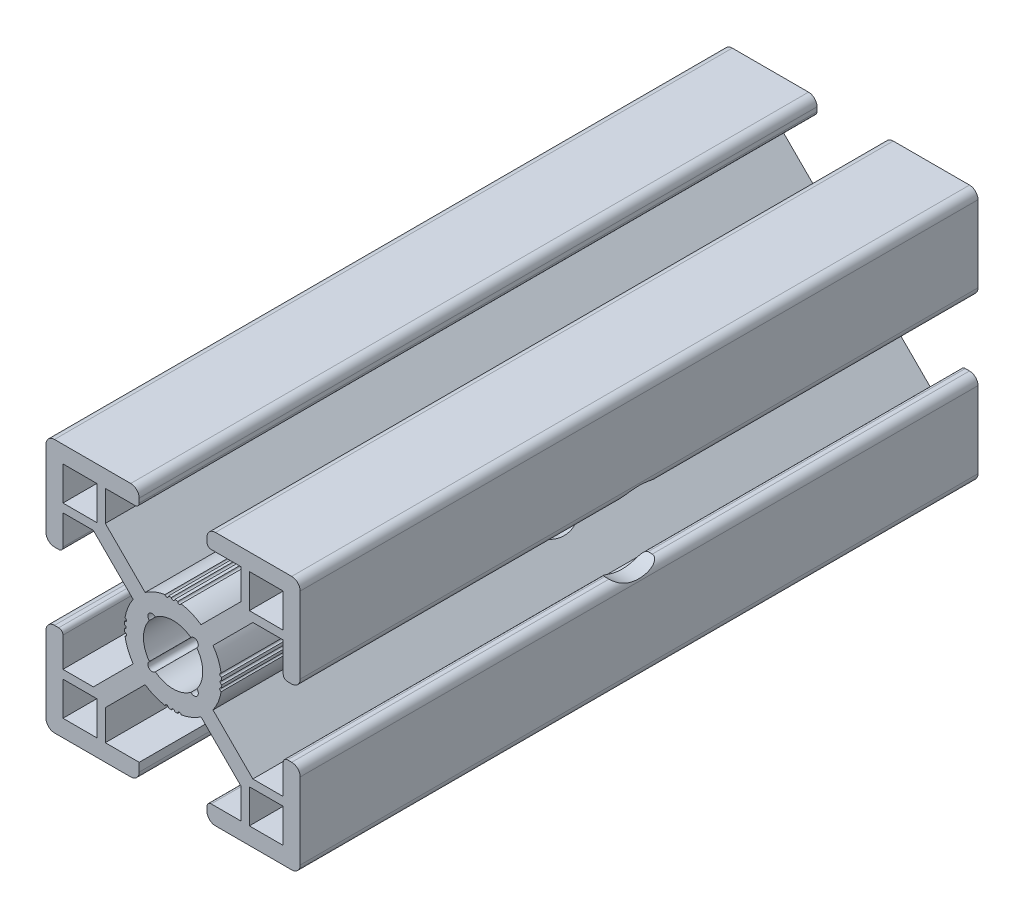
from build123d import *

# Parameters (mm, degrees)
SKETCH1_W               = 4
SKETCH1_H               = 4
BOSS_EXTRUDE1_DEPTH     = 40
CUT_EXTRUDE1_DEPTH      = 46.276925691
CUT_EXTRUDE1_DEPTH_BACK = 46.276925691
SKETCH2_R               = 4.75


with BuildPart() as part:
    # Sketch1 → Boss-Extrude1 (new, symmetric)
    with BuildSketch(Plane.XY):
        with BuildLine():
            Line((-15, 14), (-15, 5))
            ThreePointArc((-15, 5), (-14.707106781, 4.292893219), (-14, 4))
            Line((-14, 4), (-13.5, 4))
            ThreePointArc((-13.5, 4), (-13.146446609, 4.146446609), (-13, 4.5))
            Line((-13, 4.5), (-13, 8))
            Line((-13, 8), (-9.414213562, 8))
            Line((-9.414213562, 8), (-4.711011126, 3.296797563))
            ThreePointArc((-4.711011126, 3.296797563), (-5.322383956, 2.17594325), (-5.671345569, 0.947807702))
            ThreePointArc((-5.671345569, 0.947807702), (-5.502585747, 0.723913043), (-5.723511591, 0.551284925))
            ThreePointArc((-5.723511591, 0.551284925), (-5.737706139, 0.375803491), (-5.746521739, 0.199969752))
            ThreePointArc((-5.746521739, 0.199969752), (-5.607354194, 0.140186212), (-5.55, 0))
            ThreePointArc((-5.55, 0), (-5.607354194, -0.140186212), (-5.746521739, -0.199969752))
            ThreePointArc((-5.746521739, -0.199969752), (-5.737706139, -0.375803491), (-5.723511591, -0.551284925))
            ThreePointArc((-5.723511591, -0.551284925), (-5.502585747, -0.723913043), (-5.671345569, -0.947807702))
            ThreePointArc((-5.671345569, -0.947807702), (-5.322383956, -2.17594325), (-4.711011126, -3.296797563))
            Line((-4.711011126, -3.296797563), (-9.414213562, -8))
            Line((-9.414213562, -8), (-13, -8))
            Line((-13, -8), (-13, -4.5))
            ThreePointArc((-13, -4.5), (-13.146446609, -4.146446609), (-13.5, -4))
            Line((-13.5, -4), (-14, -4))
            ThreePointArc((-14, -4), (-14.707106781, -4.292893219), (-15, -5))
            Line((-15, -5), (-15, -14))
            ThreePointArc((-15, -14), (-14.707106781, -14.707106781), (-14, -15))
            Line((-14, -15), (-5, -15))
            ThreePointArc((-5, -15), (-4.292893219, -14.707106781), (-4, -14))
            Line((-4, -14), (-4, -13))
            Line((-4, -13), (-8, -13))
            Line((-8, -13), (-8, -9.414213562))
            Line((-8, -9.414213562), (-3.296797563, -4.711011126))
            ThreePointArc((-3.296797563, -4.711011126), (-2.17594325, -5.322383956), (-0.947807702, -5.671345569))
            ThreePointArc((-0.947807702, -5.671345569), (-0.723913043, -5.502585747), (-0.551284925, -5.723511591))
            ThreePointArc((-0.551284925, -5.723511591), (-0.375803491, -5.737706139), (-0.199969752, -5.746521739))
            ThreePointArc((-0.199969752, -5.746521739), (-0.140186212, -5.607354194), (0, -5.55))
            ThreePointArc((0, -5.55), (0.140186212, -5.607354194), (0.199969752, -5.746521739))
            ThreePointArc((0.199969752, -5.746521739), (0.375803491, -5.737706139), (0.551284925, -5.723511591))
            ThreePointArc((0.551284925, -5.723511591), (0.723913043, -5.502585747), (0.947807702, -5.671345569))
            ThreePointArc((0.947807702, -5.671345569), (2.17594325, -5.322383956), (3.296797563, -4.711011126))
            Line((3.296797563, -4.711011126), (8, -9.414213562))
            Line((8, -9.414213562), (8, -13))
            Line((8, -13), (4.5, -13))
            ThreePointArc((4.5, -13), (4.146446609, -13.146446609), (4, -13.5))
            Line((4, -13.5), (4, -14))
            ThreePointArc((4, -14), (4.292893219, -14.707106781), (5, -15))
            Line((5, -15), (14, -15))
            ThreePointArc((14, -15), (14.707106781, -14.707106781), (15, -14))
            Line((15, -14), (15, -5))
            ThreePointArc((15, -5), (14.707106781, -4.292893219), (14, -4))
            Line((14, -4), (13.5, -4))
            ThreePointArc((13.5, -4), (13.146446609, -4.146446609), (13, -4.5))
            Line((13, -4.5), (13, -8))
            Line((13, -8), (9.414213562, -8))
            Line((9.414213562, -8), (4.711011126, -3.296797563))
            ThreePointArc((4.711011126, -3.296797563), (5.322383956, -2.17594325), (5.671345569, -0.947807702))
            ThreePointArc((5.671345569, -0.947807702), (5.502585747, -0.723913043), (5.723511591, -0.551284925))
            ThreePointArc((5.723511591, -0.551284925), (5.737706139, -0.375803491), (5.746521739, -0.199969752))
            ThreePointArc((5.746521739, -0.199969752), (5.607354194, -0.140186212), (5.55, 0))
            ThreePointArc((5.55, 0), (5.607354194, 0.140186212), (5.746521739, 0.199969752))
            ThreePointArc((5.746521739, 0.199969752), (5.737706139, 0.375803491), (5.723511591, 0.551284925))
            ThreePointArc((5.723511591, 0.551284925), (5.502585747, 0.723913043), (5.671345569, 0.947807702))
            ThreePointArc((5.671345569, 0.947807702), (5.322383956, 2.17594325), (4.711011126, 3.296797563))
            Line((4.711011126, 3.296797563), (9.414213562, 8))
            Line((9.414213562, 8), (13, 8))
            Line((13, 8), (13, 4.5))
            ThreePointArc((13, 4.5), (13.146446609, 4.146446609), (13.5, 4))
            Line((13.5, 4), (14, 4))
            ThreePointArc((14, 4), (14.707106781, 4.292893219), (15, 5))
            Line((15, 5), (15, 14))
            ThreePointArc((15, 14), (14.707106781, 14.707106781), (14, 15))
            Line((14, 15), (5, 15))
            ThreePointArc((5, 15), (4.292893219, 14.707106781), (4, 14))
            Line((4, 14), (4, 13.5))
            ThreePointArc((4, 13.5), (4.146446609, 13.146446609), (4.5, 13))
            Line((4.5, 13), (8, 13))
            Line((8, 13), (8, 9.414213562))
            Line((8, 9.414213562), (3.296797563, 4.711011126))
            ThreePointArc((3.296797563, 4.711011126), (2.17594325, 5.322383956), (0.947807702, 5.671345569))
            ThreePointArc((0.947807702, 5.671345569), (0.723913043, 5.502585747), (0.551284925, 5.723511591))
            ThreePointArc((0.551284925, 5.723511591), (0.375803491, 5.737706139), (0.199969752, 5.746521739))
            ThreePointArc((0.199969752, 5.746521739), (0.140186212, 5.607354194), (0, 5.55))
            ThreePointArc((0, 5.55), (-0.140186212, 5.607354194), (-0.199969752, 5.746521739))
            ThreePointArc((-0.199969752, 5.746521739), (-0.375803491, 5.737706139), (-0.551284925, 5.723511591))
            ThreePointArc((-0.551284925, 5.723511591), (-0.723913043, 5.502585747), (-0.947807702, 5.671345569))
            ThreePointArc((-0.947807702, 5.671345569), (-2.17594325, 5.322383956), (-3.296797563, 4.711011126))
            Line((-3.296797563, 4.711011126), (-8, 9.414213562))
            Line((-8, 9.414213562), (-8, 13))
            Line((-8, 13), (-4.5, 13))
            ThreePointArc((-4.5, 13), (-4.146446609, 13.146446609), (-4, 13.5))
            Line((-4, 13.5), (-4, 14))
            ThreePointArc((-4, 14), (-4.292893219, 14.707106781), (-5, 15))
            Line((-5, 15), (-14, 15))
            ThreePointArc((-14, 15), (-14.707106781, 14.707106781), (-15, 14))
        make_face()
        with Locations((-11, -11)):
            Rectangle(SKETCH1_W, SKETCH1_H, mode=Mode.SUBTRACT)
        with Locations((11, -11)):
            Rectangle(SKETCH1_W, SKETCH1_H, mode=Mode.SUBTRACT)
        with BuildLine():
            ThreePointArc((-2.096969605, 2.802270236), (-1.105000944, 3.320989749), (0, 3.5))
            ThreePointArc((0, 3.5), (1.105000944, 3.320989749), (2.096969605, 2.802270236))
            ThreePointArc((2.096969605, 2.802270236), (2.828427125, 2.828427125), (2.802270236, 2.096969605))
            ThreePointArc((2.802270236, 2.096969605), (3.320989749, 1.105000944), (3.5, 0))
            ThreePointArc((3.5, 0), (3.320989749, -1.105000944), (2.802270236, -2.096969605))
            ThreePointArc((2.802270236, -2.096969605), (2.828427125, -2.828427125), (2.096969605, -2.802270236))
            ThreePointArc((2.096969605, -2.802270236), (1.105000944, -3.320989749), (0, -3.5))
            ThreePointArc((0, -3.5), (-1.105000944, -3.320989749), (-2.096969605, -2.802270236))
            ThreePointArc((-2.096969605, -2.802270236), (-2.828427125, -2.828427125), (-2.802270236, -2.096969605))
            ThreePointArc((-2.802270236, -2.096969605), (-3.320989749, -1.105000944), (-3.5, 0))
            ThreePointArc((-3.5, 0), (-3.320989749, 1.105000944), (-2.802270236, 2.096969605))
            ThreePointArc((-2.802270236, 2.096969605), (-2.828427125, 2.828427125), (-2.096969605, 2.802270236))
        make_face(mode=Mode.SUBTRACT)
        with Locations((-11, 11)):
            Rectangle(SKETCH1_W, SKETCH1_H, mode=Mode.SUBTRACT)
        with Locations((11, 11)):
            Rectangle(SKETCH1_W, SKETCH1_H, mode=Mode.SUBTRACT)
    extrude(amount=BOSS_EXTRUDE1_DEPTH, both=True)

    # Sketch2 → Cut-Extrude1 (cut, two sides: drawn at the far end of the back side and taken through both)
    with BuildSketch(Plane(origin=(0, 0, 0), x_dir=(0, 0, -1), z_dir=(1, 0, 0)).offset(-CUT_EXTRUDE1_DEPTH_BACK)):
        Circle(SKETCH2_R)
    extrude(amount=CUT_EXTRUDE1_DEPTH + CUT_EXTRUDE1_DEPTH_BACK, mode=Mode.SUBTRACT)


solid = part.part
